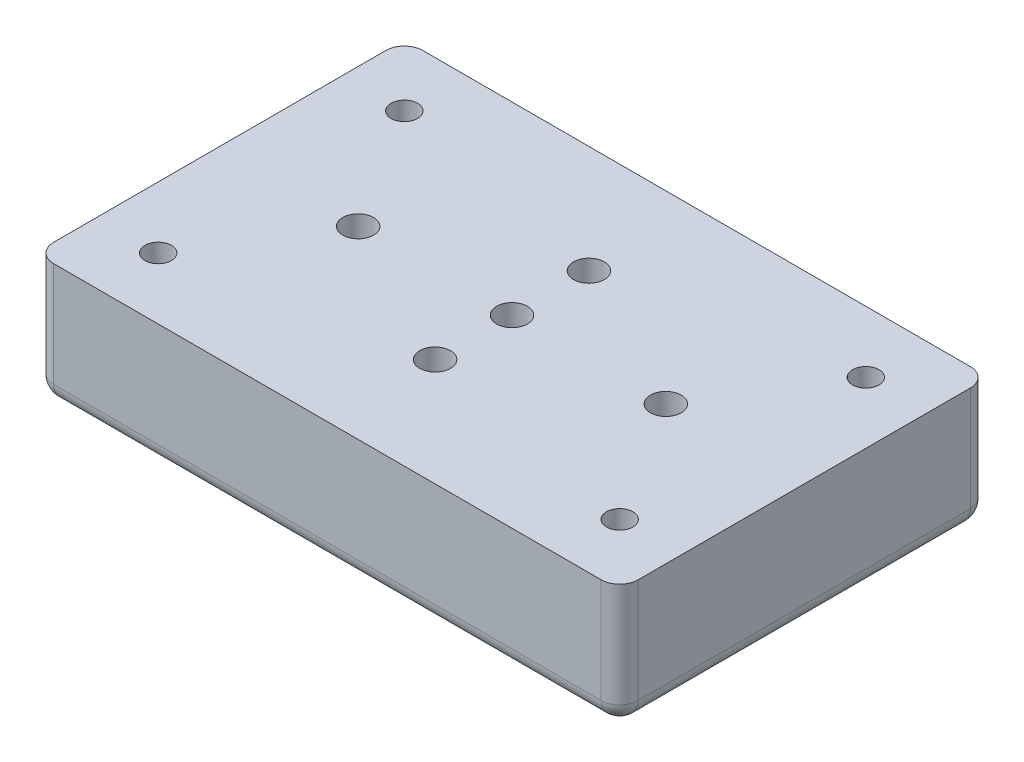
from build123d import *

# Parameters (mm, degrees)
SKETCH1_W                                   = 95
SKETCH1_H                                   = 60
BOSS_EXTRUDE1_DEPTH                         = 20
CBORE_FOR_M4_CHEESE_HEAD_SCREW1_D           = 4.3
CBORE_FOR_M4_CHEESE_HEAD_SCREW1_CBORE_D     = 7.2
CBORE_FOR_M4_CHEESE_HEAD_SCREW1_CBORE_DEPTH = 4
F_5_0MM_DOWEL_HOLE1_D                       = 5
FILLET1_R                                   = 3


with BuildPart() as part:
    # Sketch1 → Boss-Extrude1 (new body)
    with BuildSketch(Plane(origin=(0, 0, 0), x_dir=(1, 0, 0), z_dir=(0, 1, 0))):
        with Locations((-55.020594587, -80.750619844)):
            Rectangle(SKETCH1_W, SKETCH1_H)
    extrude(amount=BOSS_EXTRUDE1_DEPTH)

    # CBORE for M4 Cheese Head Screw1 (through all)
    with Locations(Plane(origin=(0, 0, 0), x_dir=(-1, 0, 0), z_dir=(0, -1, 0))):
        with Locations((17.520594587, -60.750619844), (92.520594587, -60.750619844), (92.520594587, -100.750619844), (17.520594587, -100.750619844)):
            CounterBoreHole(CBORE_FOR_M4_CHEESE_HEAD_SCREW1_D / 2, CBORE_FOR_M4_CHEESE_HEAD_SCREW1_CBORE_D / 2, CBORE_FOR_M4_CHEESE_HEAD_SCREW1_CBORE_DEPTH)

    # Ø5.0mm Dowel Hole1 (through all)
    with Locations(Plane(origin=(0, 0, 0), x_dir=(-1, 0, 0), z_dir=(0, -1, 0))):
        with Locations((30.020594587, -80.750619844), (55.020594587, -80.750619844), (80.020594587, -80.750619844), (55.020594587, -68.250619844), (55.020594587, -93.250619844)):
            Hole(F_5_0MM_DOWEL_HOLE1_D / 2)

    # Fillet1
    fillet1_edges = [part.edges().sort_by_distance(p)[0] for p in [
        (-55.020594587, 0, 50.750619844),
        (-7.520594587, 0, 80.750619844),
        (-55.020594587, 0, 110.750619844),
        (-102.520594587, 0, 80.750619844),
        (-102.520594587, 10, 50.750619844),
        (-7.520594587, 10, 50.750619844),
        (-7.520594587, 10, 110.750619844),
        (-102.520594587, 10, 110.750619844),
    ]]
    fillet(fillet1_edges, radius=FILLET1_R)


solid = part.part
